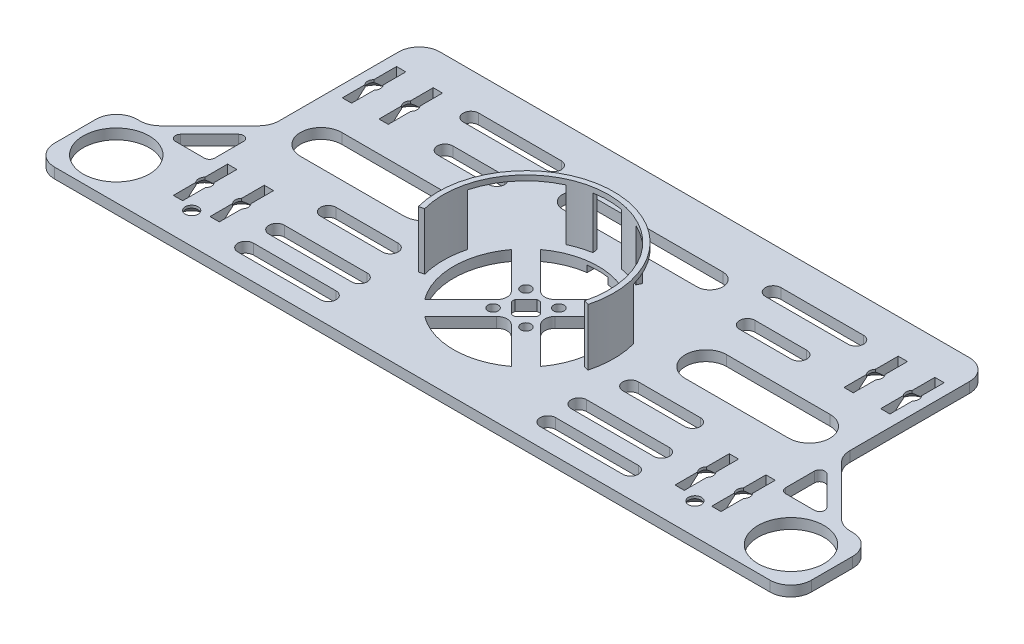
from build123d import *

# Parameters (mm, degrees)
SKETCH_1_R                     = 0.9999999999999981
SKETCH_1_R_2                   = 6.4000000000000075
SKETCH_1_W                     = 1.8000000000000043
SKETCH_1_H                     = 10.5
SKETCH_1_R_3                   = 1
SKETCH_1_R_4                   = 0.9999999999999135
SKETCH_1_R_5                   = 6.400000000000021
SKETCH_1_R_6                   = 1.0000000000000269
SKETCH_1_R_7                   = 0.9999999999999996
EXTRUDE_1_DEPTH                = 2
FILLET_1_R                     = 2
FILLET_2_R                     = 4
FILLET_3_R                     = 1
CUT_EXTRUDE_1_DEPTH            = 2
HOLE_WIZARD_M2_5_1_AT_2_COUNT  = 2
HOLE_WIZARD_M2_5_1_AT_2_PITCH  = 7.099999999999994
HOLE_WIZARD_M2_5_1_AT_3_COUNT  = 2
HOLE_WIZARD_M2_5_1_AT_3_PITCH  = 97.1
HOLE_WIZARD_M2_5_1_AT_4_COUNT  = 2
HOLE_WIZARD_M2_5_1_AT_4_PITCH  = 104.19999999999999
HOLE_WIZARD_M2_5_1_AT_5_COUNT  = 2
HOLE_WIZARD_M2_5_1_AT_5_PITCH  = 109.21048484463378
HOLE_WIZARD_M2_5_1_AT_6_COUNT  = 2
HOLE_WIZARD_M2_5_1_AT_6_PITCH  = 102.45828419410499
HOLE_WIZARD_M2_5_1_AT_7_COUNT  = 2
HOLE_WIZARD_M2_5_1_AT_7_PITCH  = 33.4619186538965
HOLE_WIZARD_M2_5_1_AT_8_COUNT  = 2
HOLE_WIZARD_M2_5_1_AT_8_PITCH  = 32.69999999999979
HOLE_WIZARD_M2_5_1_AT_9_COUNT  = 2
HOLE_WIZARD_M2_5_1_AT_9_PITCH  = 38.84906691286142
HOLE_WIZARD_M2_5_1_AT_10_COUNT = 2
HOLE_WIZARD_M2_5_1_AT_10_PITCH = 107.97374680912014
EXTRUDE_2_DEPTH                = 10
EXTRUDE_3_DEPTH                = 1
CUT_EXTRUDE_2_DEPTH            = 1.25


with BuildPart() as part:
    # 草图1 → 凸台-拉伸1 (new body)
    with BuildSketch(Plane(origin=(0, 0, 0), x_dir=(1, 0, 0), z_dir=(0, 1, 0))):
        Polygon((-73.24999999999999, 16), (-73.24999999999999, 0), (73.24999999999999, 0), (73.24999999999999, 16), (67.07842712474623, 15.999999999999996), (55.25000000000001, 27.828427124746064), (55.25000000000001, 56.6), (-55.25000000000001, 56.6), (-55.25000000000001, 27.828427124746064), (-67.07842712474623, 15.999999999999996), align=None)
        with Locations(Location((-48.7, 6, 0), (0, 0, 270))):
            Circle(SKETCH_1_R, mode=Mode.SUBTRACT)
        with Locations(Location((-65.3, 8, 0), (0, 0, 270))):
            Circle(SKETCH_1_R_2, mode=Mode.SUBTRACT)
        Polygon((-51.19999999999999, 17.25), (-51.19999999999999, 6.750000000000007), (-52.99999999999999, 6.750000000000041), (-52.99999999999999, 17.250000000000004), align=None, mode=Mode.SUBTRACT)
        with Locations((-45.000000000000014, 12)):
            Rectangle(SKETCH_1_W, SKETCH_1_H, mode=Mode.SUBTRACT)
        with BuildLine():
            ThreePointArc((8.383745408759548, 10.78782746649414), (6.22e-15, 8), (-8.38374540875954, 10.78782746649413))
            Line((-8.383745408759543, 10.787827466494134), (-1.78e-15, 19.171572875253787))
            Line((1.78e-15, 19.171572875253787), (8.383745408759546, 10.787827466494136))
        make_face(mode=Mode.SUBTRACT)
        Polygon((-55.25000000000001, 24.999999999999883), (-55.25000000000001, 16.000000000000018), (-64.24999999999999, 16.000000000000014), align=None, mode=Mode.SUBTRACT)
        with Locations(Location((-3.1819805153393768, 18.818019484660446, 0), (0, 0, 270))):
            Circle(SKETCH_1_R_3, mode=Mode.SUBTRACT)
        with BuildLine():
            Line((-11.212172533505756, 30.383745408759683), (-2.828427124746172, 21.999999999999993))
            Line((-2.828427124746174, 21.999999999999993), (-11.212172533505752, 13.61625459124031))
            ThreePointArc((-11.212172533505749, 13.616254591240303), (-14.000000000000002, 21.999999999999993), (-11.212172533505765, 30.383745408759676))
        make_face(mode=Mode.SUBTRACT)
        with Locations(Location((-3.181980515339445, 25.181980515339475, 0), (0, 0, 270))):
            Circle(SKETCH_1_R_4, mode=Mode.SUBTRACT)
        with Locations(Location((48.7, 6, 0), (0, 0, 270))):
            Circle(SKETCH_1_R, mode=Mode.SUBTRACT)
        with Locations((45.000000000000014, 12)):
            Rectangle(SKETCH_1_W, SKETCH_1_H, mode=Mode.SUBTRACT)
        Polygon((51.19999999999999, 6.750000000000007), (51.19999999999999, 17.25), (52.99999999999999, 17.250000000000004), (52.99999999999999, 6.7500000000000036), align=None, mode=Mode.SUBTRACT)
        with Locations(Location((65.3, 8, 0), (0, 0, 270))):
            Circle(SKETCH_1_R_5, mode=Mode.SUBTRACT)
        with Locations(Location((3.181980515339474, 18.818019484660546, 0), (0, 0, 270))):
            Circle(SKETCH_1_R_6, mode=Mode.SUBTRACT)
        with BuildLine():
            Line((0.35355339059328084, 24.474873734152915), (2.4748737341529257, 22.35355339059325))
            ThreePointArc((2.4748737341529194, 22.353553390593248), (2.4999999999999996, 21.999999999999996), (2.474873734152919, 21.646446609406745))
            Line((2.4748737341529217, 21.646446609406745), (0.35355339059329083, 19.525126265847085))
            ThreePointArc((0.3535533905932904, 19.525126265847085), (1.61e-15, 19.5), (-0.3535533905932877, 19.525126265847085))
            Line((-0.35355339059328833, 19.52512626584708), (-2.4748737341529194, 21.646446609406738))
            ThreePointArc((-2.4748737341529177, 21.646446609406738), (-2.5, 21.999999999999993), (-2.47487373415292, 22.353553390593248))
            Line((-2.474873734152923, 22.353553390593248), (-0.3535533905932824, 24.47487373415292))
            ThreePointArc((-0.3535533905932774, 24.474873734152915), (1.72e-15, 24.5), (0.3535533905932807, 24.474873734152915))
        make_face(mode=Mode.SUBTRACT)
        with BuildLine():
            Line((2.8284271247461756, 22), (11.212172533505754, 30.383745408759687))
            ThreePointArc((11.212172533505756, 30.383745408759687), (14, 22), (11.212172533505752, 13.616254591240306))
            Line((11.212172533505752, 13.616254591240304), (2.828427124746172, 21.999999999999996))
        make_face(mode=Mode.SUBTRACT)
        with Locations(Location((3.1819805153394416, 25.181980515339482, 0), (0, 0, 270))):
            Circle(SKETCH_1_R_7, mode=Mode.SUBTRACT)
        Polygon((64.24999999999999, 16.000000000000014), (55.25000000000001, 16.000000000000018), (55.25000000000001, 24.999999999999883), align=None, mode=Mode.SUBTRACT)
        with BuildLine():
            Line((8.383745408759546, 33.21217253350586), (0, 24.828427124746206))
            Line((0, 24.828427124746206), (-8.383745408759546, 33.212172533505864))
            ThreePointArc((-8.383745408759546, 33.212172533505864), (4.44e-15, 36), (8.383745408759552, 33.21217253350586))
        make_face(mode=Mode.SUBTRACT)
        Polygon((-52.99999999999999, 49.94999999999979), (-51.19999999999999, 49.94999999999979), (-51.19999999999999, 39.44999999999979), (-52.999999999999986, 39.44999999999979), align=None, mode=Mode.SUBTRACT)
        Polygon((-45.900000000000006, 49.94999999999978), (-44.1, 49.94999999999979), (-44.1, 39.44999999999978), (-45.900000000000006, 39.44999999999978), align=None, mode=Mode.SUBTRACT)
        with BuildLine():
            ThreePointArc((-13, 42.09999999999999), (-15.500000000000009, 44.599999999999994), (-13, 47.1))
            Line((-13, 47.1), (13, 47.1))
            ThreePointArc((13, 47.1), (15.500000000000009, 44.599999999999994), (13, 42.09999999999999))
            Line((13, 42.09999999999999), (-13, 42.09999999999999))
        make_face(mode=Mode.SUBTRACT)
        Polygon((44.1, 39.44999999999978), (44.1, 49.94999999999979), (45.900000000000006, 49.94999999999978), (45.900000000000006, 39.44999999999978), align=None, mode=Mode.SUBTRACT)
        Polygon((51.19999999999999, 39.44999999999979), (51.19999999999999, 49.94999999999979), (52.99999999999999, 49.94999999999979), (52.999999999999986, 39.44999999999979), align=None, mode=Mode.SUBTRACT)
    extrude(amount=EXTRUDE_1_DEPTH)

    # 圆角1
    fillet_1_edges = [part.edges().sort_by_distance(p)[0] for p in [
        (2.828427124746174, 1, -22),
        (-2.828427124746173, 1, -21.999999999999993),
        (0, 1, -24.828427124746206),
        (0, 1, -19.171572875253787),
    ]]
    fillet(fillet_1_edges, radius=FILLET_1_R)

    # 圆角2
    fillet_2_edges = [part.edges().sort_by_distance(p)[0] for p in [
        (-55.25000000000001, 1, -56.6),
        (55.25000000000001, 1, -56.6),
        (55.25000000000001, 1, -27.828427124746064),
        (67.07842712474623, 1, -15.999999999999996),
        (73.24999999999999, 1, -16),
        (73.24999999999999, 1, 0),
        (-73.24999999999999, 1, 0),
        (-73.24999999999999, 1, -16),
        (-67.07842712474623, 1, -15.999999999999996),
        (-55.25000000000001, 1, -27.828427124746064),
    ]]
    fillet(fillet_2_edges, radius=FILLET_2_R)

    # 圆角3
    fillet_3_edges = [part.edges().sort_by_distance(p)[0] for p in [
        (55.25000000000001, 1, -24.999999999999883),
        (55.25000000000001, 1, -16.000000000000018),
        (64.24999999999999, 1, -16.000000000000014),
        (-55.25000000000001, 1, -16.000000000000018),
        (-55.25000000000001, 1, -24.999999999999883),
        (-64.24999999999999, 1, -16.000000000000014),
    ]]
    fillet(fillet_3_edges, radius=FILLET_3_R)

    # 草图10 → 切除-拉伸1 (cut)
    with BuildSketch(Plane.XZ):
        with BuildLine():
            Line((27.25, -25.600000000000023), (47.24999999999999, -25.600000000000037))
            ThreePointArc((47.24999999999999, -25.600000000000037), (51.250000000000014, -29.599999999999994), (47.25, -33.6))
            Line((47.25, -33.6), (27.249999999999996, -33.60000000000001))
            ThreePointArc((27.249999999999996, -33.60000000000001), (23.25000000000002, -29.6), (27.25, -25.600000000000023))
        make_face()
        with BuildLine():
            Line((-27.249999999999993, -25.60000000000003), (-47.24999999999999, -25.600000000000048))
            ThreePointArc((-47.24999999999999, -25.600000000000048), (-51.25, -29.600000000000012), (-47.249999999999986, -33.600000000000016))
            Line((-47.249999999999986, -33.600000000000016), (-27.24999999999999, -33.600000000000016))
            ThreePointArc((-27.24999999999999, -33.600000000000016), (-23.250000000000014, -29.600000000000012), (-27.249999999999993, -25.60000000000003))
        make_face()
        with BuildLine():
            Line((23.250000000000007, -17.499999999999996), (35.25000000000001, -17.499999999999996))
            ThreePointArc((35.25000000000001, -17.499999999999996), (36.75, -19), (35.25000000000001, -20.499999999999993))
            Line((35.25000000000001, -20.499999999999993), (23.250000000000007, -20.499999999999993))
            ThreePointArc((23.250000000000007, -20.499999999999993), (21.750000000000004, -19), (23.250000000000007, -17.499999999999996))
        make_face()
        with BuildLine():
            Line((21.25000000000001, -9.499999999999993), (37.25000000000001, -9.499999999999993))
            ThreePointArc((37.25000000000001, -9.499999999999993), (38.75, -11), (37.25000000000001, -12.499999999999993))
            Line((37.25000000000001, -12.499999999999993), (21.25000000000001, -12.499999999999993))
            ThreePointArc((21.25000000000001, -12.499999999999993), (19.75, -11), (21.25000000000001, -9.499999999999993))
        make_face()
        with BuildLine():
            Line((21.25000000000001, -3.499999999999994), (37.25000000000001, -3.499999999999994))
            ThreePointArc((37.25000000000001, -3.499999999999994), (38.75, -5), (37.25000000000001, -6.499999999999991))
            Line((37.25000000000001, -6.499999999999991), (21.25000000000001, -6.499999999999991))
            ThreePointArc((21.25000000000001, -6.499999999999991), (19.75, -5), (21.25000000000001, -3.499999999999994))
        make_face()
        with BuildLine():
            Line((24.250000000000007, -39.1), (34.25000000000001, -39.1))
            ThreePointArc((34.25000000000001, -39.1), (35.75000000000001, -40.6), (34.25000000000001, -42.1))
            Line((34.25000000000001, -42.1), (24.250000000000007, -42.1))
            ThreePointArc((24.250000000000007, -42.1), (22.750000000000007, -40.6), (24.250000000000007, -39.1))
        make_face()
        with BuildLine():
            Line((21.25000000000001, -47.1), (37.25000000000001, -47.1))
            ThreePointArc((37.25000000000001, -47.1), (38.75000000000001, -48.6), (37.25000000000001, -50.1))
            Line((37.25000000000001, -50.1), (21.25000000000001, -50.1))
            ThreePointArc((21.25000000000001, -50.1), (19.750000000000007, -48.6), (21.25000000000001, -47.1))
        make_face()
        with BuildLine():
            Line((-21.25000000000001, -3.499999999999999), (-37.25000000000001, -3.500000000000003))
            ThreePointArc((-37.25000000000001, -3.500000000000003), (-38.75, -5.00000000000001), (-37.25000000000001, -6.500000000000001))
            Line((-37.25000000000001, -6.500000000000001), (-21.25000000000001, -6.4999999999999964))
            ThreePointArc((-21.25000000000001, -6.4999999999999964), (-19.75, -5.000000000000005), (-21.25000000000001, -3.499999999999999))
        make_face()
        with BuildLine():
            Line((-21.25000000000001, -9.499999999999998), (-37.25000000000001, -9.500000000000002))
            ThreePointArc((-37.25000000000001, -9.500000000000002), (-38.75, -11.000000000000009), (-37.25000000000001, -12.5))
            Line((-37.25000000000001, -12.5), (-21.25000000000001, -12.499999999999996))
            ThreePointArc((-21.25000000000001, -12.499999999999996), (-19.75, -11.000000000000005), (-21.25000000000001, -9.499999999999998))
        make_face()
        with BuildLine():
            Line((-23.25, -17.5), (-35.25000000000001, -17.5))
            ThreePointArc((-35.25000000000001, -17.5), (-36.75, -19.000000000000007), (-35.25000000000001, -20.5))
            Line((-35.25000000000001, -20.5), (-23.25, -20.5))
            ThreePointArc((-23.25, -20.5), (-21.749999999999993, -19.000000000000007), (-23.25, -17.5))
        make_face()
        with BuildLine():
            Line((-21.249999999999996, -47.10000000000001), (-37.24999999999999, -47.10000000000001))
            ThreePointArc((-37.24999999999999, -47.10000000000001), (-38.74999999999999, -48.60000000000001), (-37.24999999999999, -50.10000000000001))
            Line((-37.24999999999999, -50.10000000000001), (-21.249999999999996, -50.10000000000001))
            ThreePointArc((-21.249999999999996, -50.10000000000001), (-19.749999999999993, -48.60000000000001), (-21.249999999999996, -47.10000000000001))
        make_face()
        with BuildLine():
            Line((-24.25, -39.10000000000001), (-34.24999999999999, -39.10000000000001))
            ThreePointArc((-34.24999999999999, -39.10000000000001), (-35.74999999999999, -40.60000000000001), (-34.24999999999999, -42.10000000000001))
            Line((-34.24999999999999, -42.10000000000001), (-24.25, -42.10000000000001))
            ThreePointArc((-24.25, -42.10000000000001), (-22.75, -40.60000000000001), (-24.25, -39.10000000000001))
        make_face()
    extrude(amount=-CUT_EXTRUDE_1_DEPTH, mode=Mode.SUBTRACT)

    # 草图12 → M2.5 平头机械螺钉的锥形沉头孔1 (revolve, cut)
    with BuildSketch(Plane(origin=(52.099999999999994, 0, -44.69999999999979), x_dir=(0, 0, -1), z_dir=(1, 0, 0))):
        Polygon((0, 0), (-4.9e-16, 2.0000000000000018), (1.2499999999999871, 2.0000000000000018), (1.2499999999999996, 1.5000000000000002), (2.749999999999999, -1.73e-15), align=None)
    hole_wizard_m2_5_1 = revolve(axis=Axis((52.099999999999994, -6.349999999999991, -44.69999999999979), (0, 1, 0)), mode=Mode.SUBTRACT)

    # M2.5 平头机械螺钉的锥形沉头孔1 at 2: M2.5 平头机械螺钉的锥形沉头孔1 ×2
    with Locations(*[(-i * HOLE_WIZARD_M2_5_1_AT_2_PITCH, 0, 0) for i in range(1, HOLE_WIZARD_M2_5_1_AT_2_COUNT)]):
        add(hole_wizard_m2_5_1, mode=Mode.SUBTRACT)

    # M2.5 平头机械螺钉的锥形沉头孔1 at 3: M2.5 平头机械螺钉的锥形沉头孔1 ×2
    with Locations(*[(-i * HOLE_WIZARD_M2_5_1_AT_3_PITCH, 0, 0) for i in range(1, HOLE_WIZARD_M2_5_1_AT_3_COUNT)]):
        add(hole_wizard_m2_5_1, mode=Mode.SUBTRACT)

    # M2.5 平头机械螺钉的锥形沉头孔1 at 4: M2.5 平头机械螺钉的锥形沉头孔1 ×2
    with Locations(*[(-i * HOLE_WIZARD_M2_5_1_AT_4_PITCH, 0, 0) for i in range(1, HOLE_WIZARD_M2_5_1_AT_4_COUNT)]):
        add(hole_wizard_m2_5_1, mode=Mode.SUBTRACT)

    # M2.5 平头机械螺钉的锥形沉头孔1 at 5: M2.5 平头机械螺钉的锥形沉头孔1 ×2
    with Locations(*[Vector(-0.9541208442416325, 0, 0.29942180044818795) * (i * HOLE_WIZARD_M2_5_1_AT_5_PITCH) for i in range(1, HOLE_WIZARD_M2_5_1_AT_5_COUNT)]):
        add(hole_wizard_m2_5_1, mode=Mode.SUBTRACT)

    # M2.5 平头机械螺钉的锥形沉头孔1 at 6: M2.5 平头机械螺钉的锥形沉头孔1 ×2
    with Locations(*[Vector(-0.947702772535661, 0, 0.319154280761235) * (i * HOLE_WIZARD_M2_5_1_AT_6_PITCH) for i in range(1, HOLE_WIZARD_M2_5_1_AT_6_COUNT)]):
        add(hole_wizard_m2_5_1, mode=Mode.SUBTRACT)

    # M2.5 平头机械螺钉的锥形沉头孔1 at 7: M2.5 平头机械螺钉的锥形沉头孔1 ×2
    with Locations(*[Vector(-0.21218149722485297, 0, 0.9772302759510778) * (i * HOLE_WIZARD_M2_5_1_AT_7_PITCH) for i in range(1, HOLE_WIZARD_M2_5_1_AT_7_COUNT)]):
        add(hole_wizard_m2_5_1, mode=Mode.SUBTRACT)

    # M2.5 平头机械螺钉的锥形沉头孔1 at 8: M2.5 平头机械螺钉的锥形沉头孔1 ×2
    with Locations(*[(0, 0, i * HOLE_WIZARD_M2_5_1_AT_8_PITCH) for i in range(1, HOLE_WIZARD_M2_5_1_AT_8_COUNT)]):
        add(hole_wizard_m2_5_1, mode=Mode.SUBTRACT)

    # M2.5 平头机械螺钉的锥形沉头孔1 at 9: M2.5 平头机械螺钉的锥形沉头孔1 ×2
    with Locations(*[Vector(-0.08751818950056645, 0, 0.9961629216682093) * (i * HOLE_WIZARD_M2_5_1_AT_9_PITCH) for i in range(1, HOLE_WIZARD_M2_5_1_AT_9_COUNT)]):
        add(hole_wizard_m2_5_1, mode=Mode.SUBTRACT)

    # M2.5 平头机械螺钉的锥形沉头孔1 at 10: M2.5 平头机械螺钉的锥形沉头孔1 ×2
    with Locations(*[Vector(-0.9335602679251082, 0, 0.35842046000695926) * (i * HOLE_WIZARD_M2_5_1_AT_10_PITCH) for i in range(1, HOLE_WIZARD_M2_5_1_AT_10_COUNT)]):
        add(hole_wizard_m2_5_1, mode=Mode.SUBTRACT)

    # 草图13 → 凸台-拉伸2 (add)
    with BuildSketch(Plane(origin=(0, 2, 0), x_dir=(1, 0, 0), z_dir=(0, 1, 0))):
        with BuildLine():
            Line((-16.42073904691419, 17.60007623325725), (-15.45481322062512, 17.858895278359768))
            ThreePointArc((-15.454813220625093, 17.858895278359668), (-16, 22.000000000000004), (-15.454813220625093, 26.14110472164033))
            Line((-15.45481322062512, 26.141104721640232), (-16.42073904691419, 26.399923766742745))
            ThreePointArc((-16.42073904691419, 26.39992376674275), (-17, 22.000000000000004), (-16.42073904691419, 17.600076233257255))
        make_face()
        with BuildLine():
            Line((-7.184510449591915, 37.40723237962304), (-6.761892187851216, 36.500924592586394))
            ThreePointArc((-6.7618921878511316, 36.50092459258643), (-4.811292792068357, 37.259471211971636), (-2.778370842670927, 37.75692404819532))
            Line((-2.7783708426709004, 37.75692404819533), (-2.9520190203378314, 38.741731801207536))
            ThreePointArc((-2.95201902033783, 38.741731801207536), (-5.1119985915726645, 38.213188162719845), (-7.184510449591916, 37.40723237962304))
        make_face()
        with BuildLine():
            Line((2.9520190203378314, 38.741731801207536), (2.7783708426709004, 37.75692404819533))
            ThreePointArc((2.7783708426709253, 37.75692404819532), (4.811292792068356, 37.259471211971636), (6.761892187851126, 36.50092459258643))
            Line((6.761892187851217, 36.5009245925864), (7.184510449591915, 37.40723237962304))
            ThreePointArc((7.184510449591914, 37.40723237962304), (5.111998591572664, 38.213188162719845), (2.9520190203378323, 38.741731801207536))
        make_face()
        with BuildLine():
            Line((16.42073904691419, 26.399923766742745), (15.45481322062512, 26.141104721640232))
            ThreePointArc((15.454813220625093, 26.141104721640332), (15.863117781980966, 24.088419075520825), (16, 22))
            ThreePointArc((16, 21.999999999999996), (15.863117781980964, 19.91158092447916), (15.45481322062509, 17.858895278359654))
            Line((15.45481322062512, 17.858895278359768), (16.42073904691419, 17.60007623325725))
            ThreePointArc((16.42073904691419, 17.60007623325725), (16.854562643354782, 19.781054732259165), (17, 21.999999999999996))
            ThreePointArc((17, 22), (16.854562643354782, 24.21894526774082), (16.42073904691419, 26.399923766742745))
        make_face()
    extrude(amount=EXTRUDE_2_DEPTH)

    # 草图14 → 凸台-拉伸3 (add)
    with BuildSketch(Plane(origin=(0, 12, 0), x_dir=(1, 0, 0), z_dir=(0, 1, 0))):
        with BuildLine():
            ThreePointArc((-15.45481322062512, 17.858895278359764), (-16, 21.999999999999996), (-15.45481322062512, 26.141104721640232))
            Line((-15.45481322062512, 26.141104721640232), (-16.420739046914193, 26.399923766742745))
            ThreePointArc((-16.420739046914193, 26.399923766742745), (-17.000000000000004, 22.000000000000004), (-16.420739046914193, 17.60007623325725))
            Line((-16.420739046914193, 17.60007623325725), (-15.45481322062512, 17.858895278359764))
        make_face()
        with BuildLine():
            Line((-16.420739046914193, 26.399923766742745), (-15.45481322062512, 26.141104721640232))
            ThreePointArc((-15.45481322062512, 26.141104721640232), (2.0884190755207745, 37.863117781980975), (16, 22))
            ThreePointArc((16, 21.999999999999996), (15.863117781980971, 19.911580924479214), (15.454813220625118, 17.858895278359764))
            Line((15.45481322062512, 17.858895278359764), (16.420739046914193, 17.60007623325725))
            ThreePointArc((16.42073904691419, 17.60007623325725), (16.854562643354782, 19.781054732259165), (17, 21.999999999999996))
            ThreePointArc((17, 22), (2.218945267740823, 38.85456264335478), (-16.42073904691419, 26.39992376674275))
        make_face()
    extrude(amount=EXTRUDE_3_DEPTH)

    # 草图15 → 切除-拉伸2 (cut)
    with BuildSketch(Plane.XZ):
        with BuildLine():
            Line((-2, -35.856406460551014), (-2, -42.09999999999999))
            Line((-2, -42.09999999999999), (0, -42.09999999999999))
            Line((0, -42.09999999999999), (0, -36))
            ThreePointArc((-3.5305e-13, -36), (-1.0025740751402004, -35.96405547195573), (-2.0000000000000004, -35.856406460551014))
        make_face()
        with BuildLine():
            Line((0, -36), (0, -42.09999999999999))
            Line((0, -42.09999999999999), (2, -42.09999999999999))
            Line((2, -42.09999999999999), (2, -35.856406460551014))
            ThreePointArc((2.0000000000000013, -35.856406460551014), (1.002574075139845, -35.96405547195576), (-3.5305e-13, -36))
        make_face()
    extrude(amount=-CUT_EXTRUDE_2_DEPTH, mode=Mode.SUBTRACT)


solid = part.part
